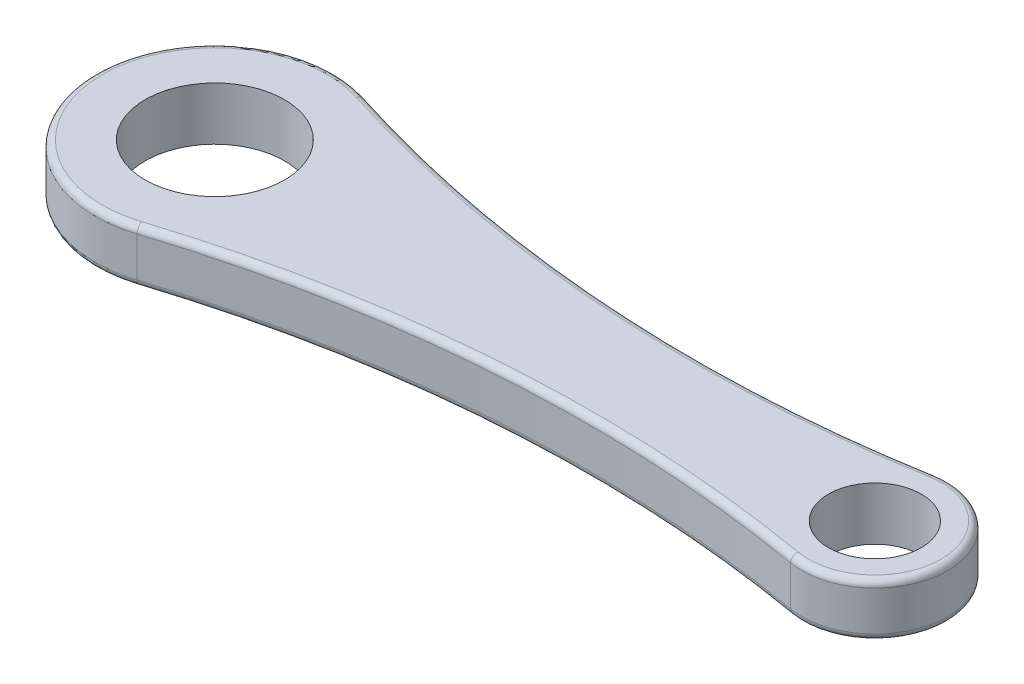
from build123d import *

# Parameters (mm, degrees)
SKETCH_1_R      = 5.25
SKETCH_1_R_2    = 3.5
EXTRUDE_1_DEPTH = 4
FILLET_1_R      = 0.5


with BuildPart() as part:
    # 草图1 → 凸台-拉伸1 (new body)
    with BuildSketch(Plane(origin=(0, 0, 0), x_dir=(1, 0, 0), z_dir=(0, 1, 0))):
        with BuildLine():
            ThreePointArc((2.725960977, 8.577245289), (-9, 0), (2.725960977, -8.577245289))
            ThreePointArc((2.725960977, -8.577245289), (25.580430084, -4.227861915), (48.814522163, -5.419859889))
            ThreePointArc((48.814522163, -5.419859889), (55.25, 0), (48.814522163, 5.419859889))
            ThreePointArc((48.814522163, 5.419859889), (25.580430084, 4.227861915), (2.725960977, 8.577245289))
        make_face()
        with Locations(Location((0, 0, 0), (0, 0, 270))):
            Circle(SKETCH_1_R, mode=Mode.SUBTRACT)
        with Locations(Location((49.75, 0, 0), (0, 0, 270))):
            Circle(SKETCH_1_R_2, mode=Mode.SUBTRACT)
    extrude(amount=EXTRUDE_1_DEPTH)

    # 圆角1
    fillet_1_edges = [part.edges().sort_by_distance(p)[0] for p in [
        (25.580430084, 4, 4.227861915),
        (55.25, 4, 0),
        (25.580430084, 4, -4.227861915),
        (55.25, 0, 0),
        (25.580430084, 0, 4.227861915),
        (-9, 0, 0),
        (25.580430084, 0, -4.227861915),
        (-9, 4, 0),
    ]]
    fillet(fillet_1_edges, radius=FILLET_1_R)


solid = part.part
